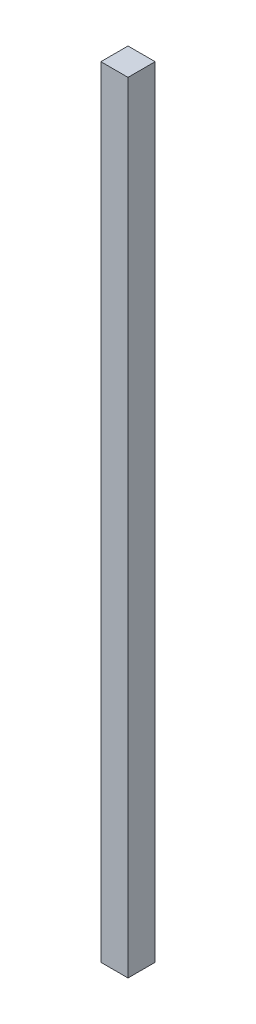
from build123d import *

# Parameters (mm, degrees)
CROQUIS1_W              = 20
CROQUIS1_H              = 20
SALIENTE_EXTRUIR1_DEPTH = 574.6


with BuildPart() as part:
    # Croquis1 → Saliente-Extruir1 (new body)
    with BuildSketch(Plane(origin=(0, 0, 0), x_dir=(1, 0, 0), z_dir=(0, 1, 0))):
        Rectangle(CROQUIS1_W, CROQUIS1_H)
    extrude(amount=SALIENTE_EXTRUIR1_DEPTH)


solid = part.part
